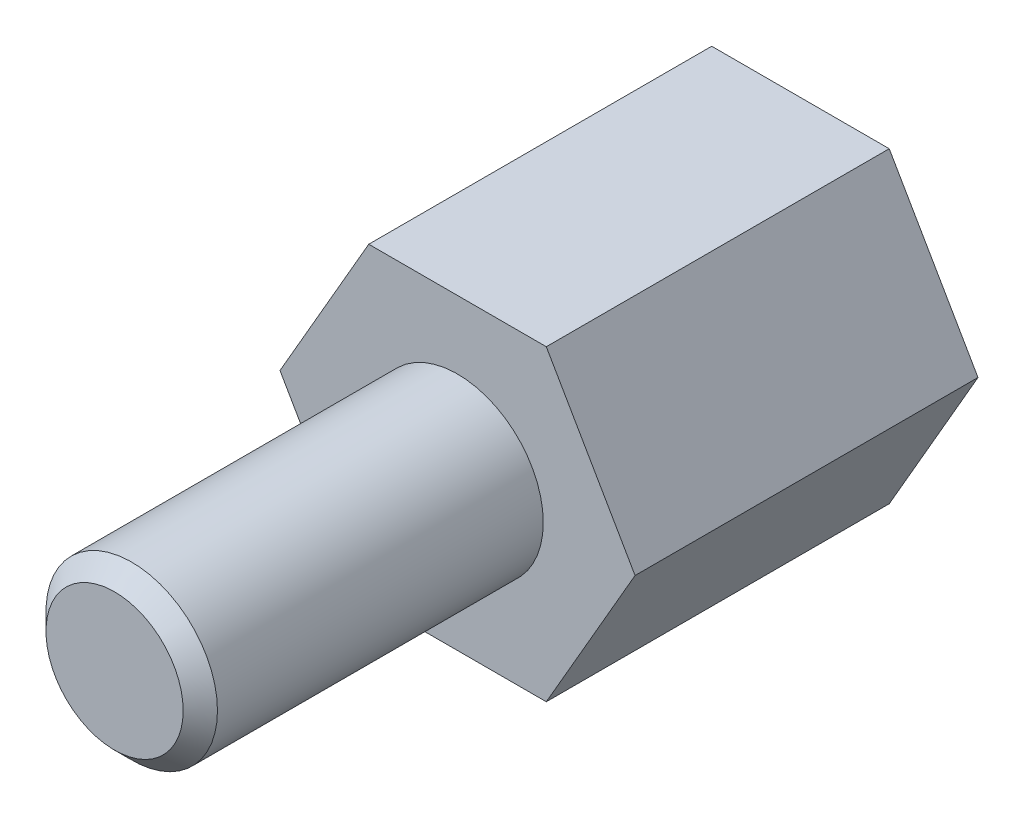
from build123d import *

# Parameters (mm, degrees)
EXTRUDE_1_DEPTH        = 6
SKETCH_2_R             = 1.5
EXTRUDE_2_DEPTH        = 6
HOLE_WIZARD_M3_1_D     = 2.5
HOLE_WIZARD_M3_1_DEPTH = 5
HOLE_WIZARD_M3_1_TIP   = 0.751075774
CHAMFER_1_SIZE         = 0.3


with BuildPart() as part:
    # 草图1 → 凸台-拉伸1 (new body)
    with BuildSketch(Plane.XY):
        Polygon((-1.553072224, 2.69), (-3.106144448, 0), (-1.553072224, -2.69), (1.553072224, -2.69), (3.106144448, 0), (1.553072224, 2.69), align=None)
    extrude(amount=EXTRUDE_1_DEPTH)

    # 草图2 → 凸台-拉伸2 (add)
    with BuildSketch(Plane.XY.offset(6)):
        Circle(SKETCH_2_R)
    extrude(amount=EXTRUDE_2_DEPTH)

    # M3 螺纹孔1
    with Locations(Plane(origin=(0, 0, 0), x_dir=(-1, 0, 0), z_dir=(0, 0, -1))):
        with Locations((0, 0)):
            Hole(HOLE_WIZARD_M3_1_D / 2, depth=HOLE_WIZARD_M3_1_DEPTH)
            with Locations((0, 0, -(HOLE_WIZARD_M3_1_DEPTH + HOLE_WIZARD_M3_1_TIP / 2))):  # 118° drill point
                Cone(0, HOLE_WIZARD_M3_1_D / 2, HOLE_WIZARD_M3_1_TIP, mode=Mode.SUBTRACT)

    # 倒角1
    chamfer_1_edges = [part.edges().sort_by_distance(p)[0] for p in [
        (-1.5, 0, 12),
    ]]
    chamfer(chamfer_1_edges, length=CHAMFER_1_SIZE)


solid = part.part
